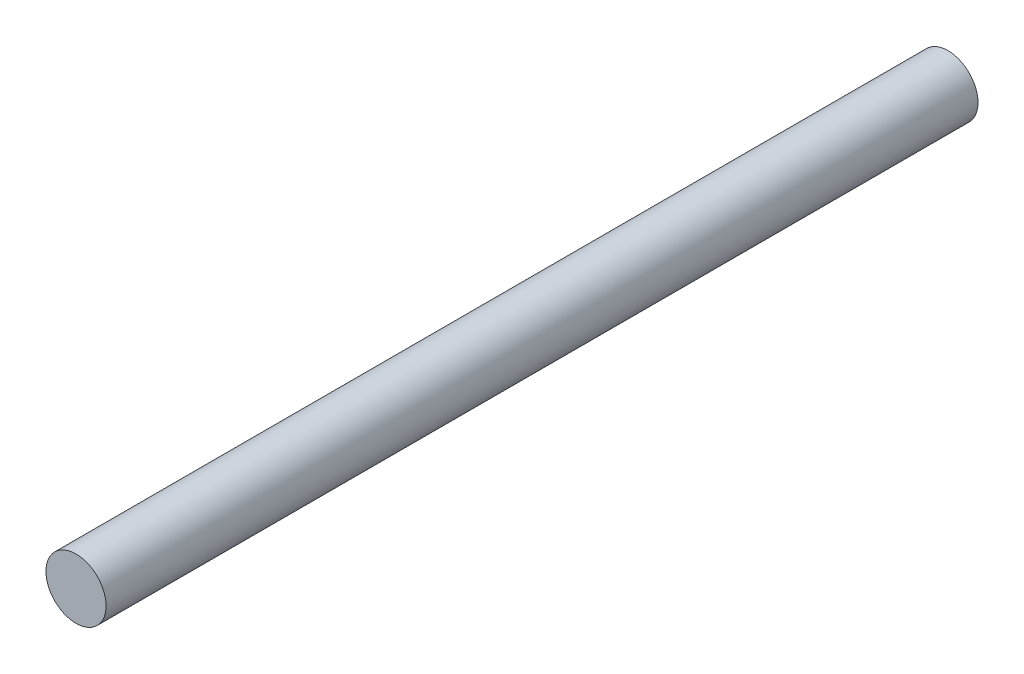
from build123d import *

# Parameters (mm, degrees)
SKETCH1_R           = 0.5
BOSS_EXTRUDE1_DEPTH = 14.5


with BuildPart() as part:
    # Sketch1 → Boss-Extrude1 (new body)
    with BuildSketch(Plane.XY):
        Circle(SKETCH1_R)
    extrude(amount=BOSS_EXTRUDE1_DEPTH)


solid = part.part
